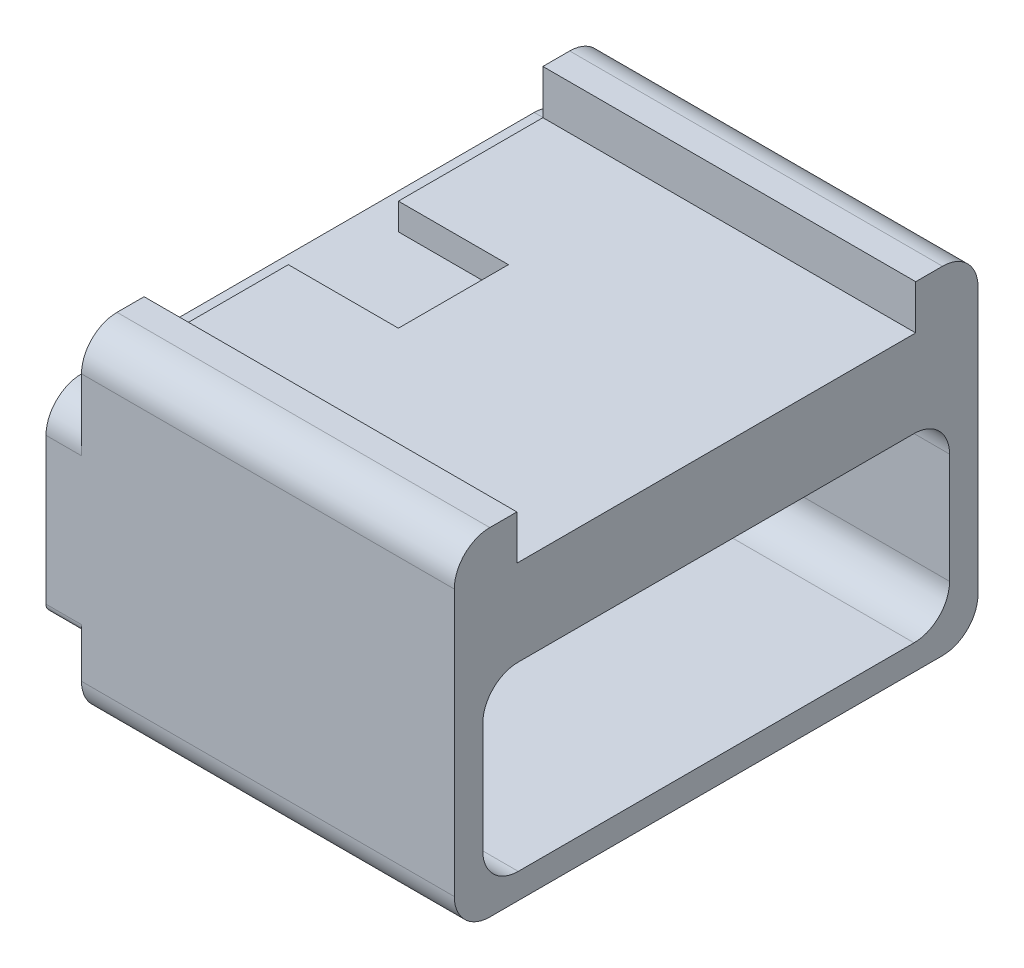
from build123d import *

# Parameters (mm, degrees)
BOSS_EXTRUDE1_DEPTH     = 21
SKETCH5_W               = 6.2
SKETCH5_H               = 6.2
CUT_EXTRUDE1_DEPTH      = 4
CUT_EXTRUDE2_DEPTH      = 28.364438602
CUT_EXTRUDE2_DEPTH_BACK = 28.364438602
SKETCH9_W               = 24.284850455
SKETCH9_H               = 22.464844075
CUT_EXTRUDE3_DEPTH      = 2.5
BOSS_EXTRUDE2_DEPTH     = 2


with BuildPart() as part:
    # Sketch3 → Boss-Extrude1 (new body)
    with BuildSketch(Plane(origin=(0, 0, 0), x_dir=(0, 0, -1), z_dir=(1, 0, 0))):
        with BuildLine():
            Line((-12.75, -9.5), (12.75, -9.5))
            ThreePointArc((12.75, -9.5), (14.164213562, -8.914213562), (14.75, -7.5))
            Line((14.75, -7.5), (14.75, 7.5))
            ThreePointArc((14.75, 7.5), (14.164213562, 8.914213562), (12.75, 9.5))
            Line((12.75, 9.5), (-12.75, 9.5))
            ThreePointArc((-12.75, 9.5), (-14.164213562, 8.914213562), (-14.75, 7.5))
            Line((-14.75, 7.5), (-14.75, -7.5))
            ThreePointArc((-14.75, -7.5), (-14.164213562, -8.914213562), (-12.75, -9.5))
        make_face()
    extrude(amount=BOSS_EXTRUDE1_DEPTH)

    # Sketch5 → Cut-Extrude1 (cut)
    with BuildSketch(Plane(origin=(0, 9.5, 0), x_dir=(1, 0, 0), z_dir=(0, 1, 0))):
        with Locations((3.1, 0)):
            Rectangle(SKETCH5_W, SKETCH5_H)
    extrude(amount=-CUT_EXTRUDE1_DEPTH, mode=Mode.SUBTRACT)

    # Sketch7 → Cut-Extrude2 (cut, two sides: drawn at the far end of the back side and taken through both)
    with BuildSketch(Plane.ZY.offset(-CUT_EXTRUDE2_DEPTH_BACK)):
        with BuildLine():
            Line((-11.147623693, -8.072928754), (11.147623693, -8.072928754))
            ThreePointArc((11.147623693, -8.072928754), (12.561837255, -7.487142316), (13.147623693, -6.072928754))
            Line((13.147623693, -6.072928754), (13.147623693, 0.135263404))
            ThreePointArc((13.147623693, 0.135263404), (12.561837255, 1.549476966), (11.147623693, 2.135263404))
            Line((11.147623693, 2.135263404), (-11.147623693, 2.135263404))
            ThreePointArc((-11.147623693, 2.135263404), (-12.561837255, 1.549476966), (-13.147623693, 0.135263404))
            Line((-13.147623693, 0.135263404), (-13.147623693, -6.072928754))
            ThreePointArc((-13.147623693, -6.072928754), (-12.561837255, -7.487142316), (-11.147623693, -8.072928754))
        make_face()
    extrude(amount=CUT_EXTRUDE2_DEPTH + CUT_EXTRUDE2_DEPTH_BACK, mode=Mode.SUBTRACT)

    # Sketch9 → Cut-Extrude3 (cut)
    with BuildSketch(Plane(origin=(0, 9.5, 0), x_dir=(1, 0, 0), z_dir=(0, 1, 0))):
        with Locations((12.142425228, 0.007615305)):
            Rectangle(SKETCH9_W, SKETCH9_H)
    extrude(amount=-CUT_EXTRUDE3_DEPTH, mode=Mode.SUBTRACT)

    # Sketch11 → Boss-Extrude2 (add)
    with BuildSketch(Plane.ZY):
        with BuildLine():
            Line((-13.647623693, -5.23512894), (-14.25, -5.23512894))
            ThreePointArc((-14.25, -5.23512894), (-14.603553391, -5.088682331), (-14.75, -4.73512894))
            Line((-14.75, -4.73512894), (-14.75, 3.5))
            ThreePointArc((-14.75, 3.5), (-14.164213562, 4.914213562), (-12.75, 5.5))
            Line((-12.75, 5.5), (12.75, 5.5))
            ThreePointArc((12.75, 5.5), (14.164213562, 4.914213562), (14.75, 3.5))
            Line((14.75, 3.5), (14.75, -4.73512894))
            ThreePointArc((14.75, -4.73512894), (14.603553391, -5.088682331), (14.25, -5.23512894))
            Line((14.25, -5.23512894), (13.647623693, -5.23512894))
            ThreePointArc((13.647623693, -5.23512894), (13.294070302, -5.088682331), (13.147623693, -4.73512894))
            Line((13.147623693, -4.73512894), (13.147623693, 0.135263404))
            ThreePointArc((13.147623693, 0.135263404), (12.561837255, 1.549476966), (11.147623693, 2.135263404))
            Line((11.147623693, 2.135263404), (-11.147623693, 2.135263404))
            ThreePointArc((-11.147623693, 2.135263404), (-12.561837255, 1.549476966), (-13.147623693, 0.135263404))
            Line((-13.147623693, 0.135263404), (-13.147623693, -4.73512894))
            ThreePointArc((-13.147623693, -4.73512894), (-13.294070302, -5.088682331), (-13.647623693, -5.23512894))
        make_face()
    extrude(amount=BOSS_EXTRUDE2_DEPTH)


solid = part.part
